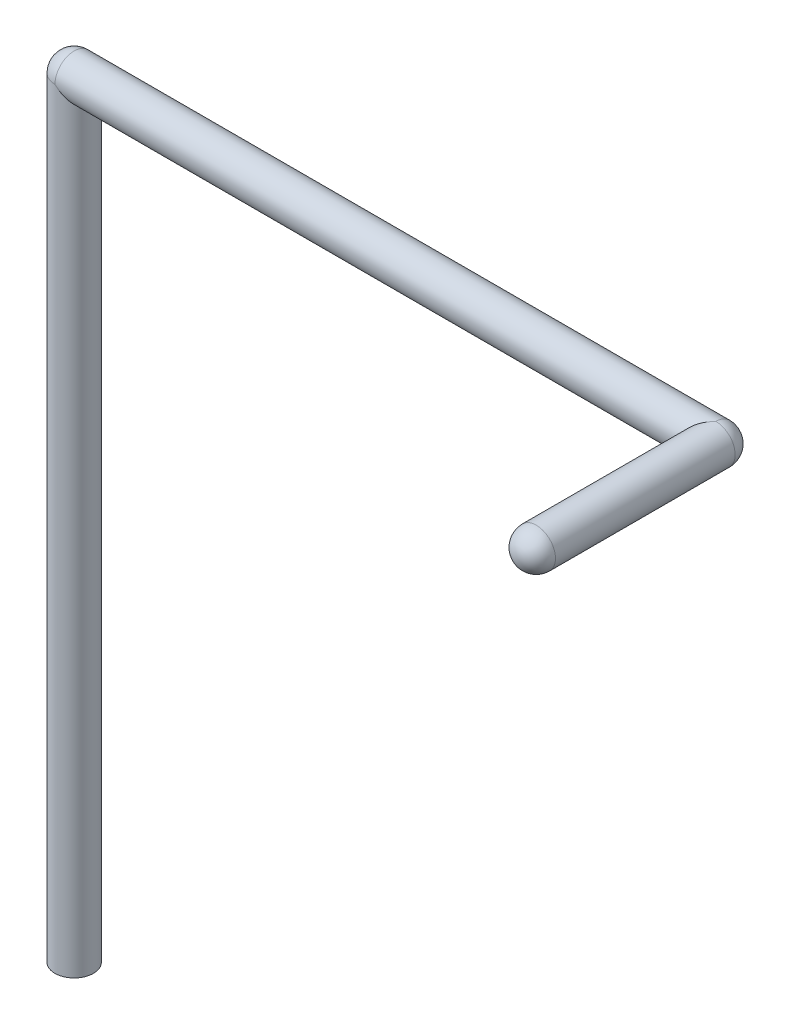
from build123d import *

# Parameters (mm, degrees)
SKETCH_1_R      = 0.75
EXTRUDE_1_DEPTH = 30
SKETCH_3_R      = 0.75
EXTRUDE_2_DEPTH = 25
SKETCH_5_R      = 0.75
EXTRUDE_3_DEPTH = 7


with BuildPart() as part:
    # 草图1 → 凸台-拉伸1 (new body)
    with BuildSketch(Plane(origin=(0, 0, 0), x_dir=(1, 0, 0), z_dir=(0, 1, 0))):
        with Locations(Location((0, 0, 0), (0, 0, 270))):
            Circle(SKETCH_1_R)
    extrude(amount=EXTRUDE_1_DEPTH)

    # 草图2 → 旋转1 (revolve)
    with BuildSketch(Plane(origin=(0, 0, 0), x_dir=(0, 0, -1), z_dir=(1, 0, 0))):
        with BuildLine():
            Line((0, 30.75), (0, 29.25))
            ThreePointArc((0, 29.25), (0.75, 30), (0, 30.75))
        make_face()
    revolve(axis=Axis((0, 30.75, 0), (0, -1, 0)))

    # 草图3 → 凸台-拉伸2 (add)
    with BuildSketch(Plane(origin=(0, 0, 0), x_dir=(0, 0, -1), z_dir=(1, 0, 0))):
        with Locations((0, 30)):
            Circle(SKETCH_3_R)
    extrude(amount=EXTRUDE_2_DEPTH)

    # 草图4 → 旋转2 (revolve)
    with BuildSketch(Plane.XY):
        with BuildLine():
            Line((24.25, 30), (25.75, 30))
            ThreePointArc((25.75, 30), (25, 30.75), (24.25, 30))
        make_face()
    revolve(axis=Axis((24.25, 30, 0), (1, 0, 0)))

    # 草图5 → 凸台-拉伸3 (add)
    with BuildSketch(Plane.XY):
        with Locations((25, 30)):
            Circle(SKETCH_5_R)
    extrude(amount=EXTRUDE_3_DEPTH)

    # 草图6 → 旋转3 (revolve)
    with BuildSketch(Plane.XY.offset(7)):
        with BuildLine():
            Line((25, 30.75), (25, 29.25))
            ThreePointArc((25, 29.25), (25.75, 30), (25, 30.75))
        make_face()
    revolve(axis=Axis((25, 30.75, 7), (0, -1, 0)))


solid = part.part
